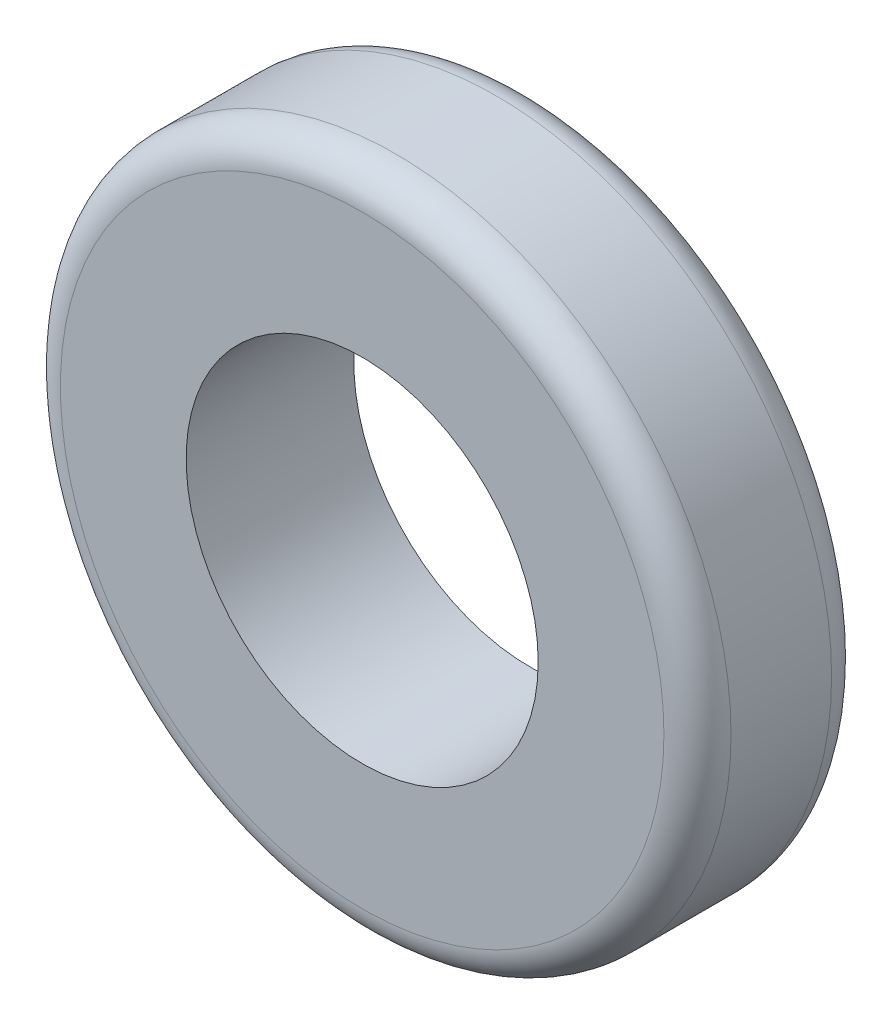
from build123d import *

# Parameters (mm, degrees)
SKETCH1_R           = 25.4
SKETCH1_R_2         = 13.335
BOSS_EXTRUDE1_DEPTH = 6.35
FILLET2_R           = 2.54


with BuildPart() as part:
    # Sketch1 → Boss-Extrude1 (new, symmetric)
    with BuildSketch(Plane.XY):
        Circle(SKETCH1_R)
        Circle(SKETCH1_R_2, mode=Mode.SUBTRACT)
    extrude(amount=BOSS_EXTRUDE1_DEPTH, both=True)

    # Fillet2
    fillet2_edges = [part.edges().sort_by_distance(p)[0] for p in [
        (-25.4, 0, -6.35),
        (-25.4, 0, 6.35),
    ]]
    fillet(fillet2_edges, radius=FILLET2_R)


solid = part.part
